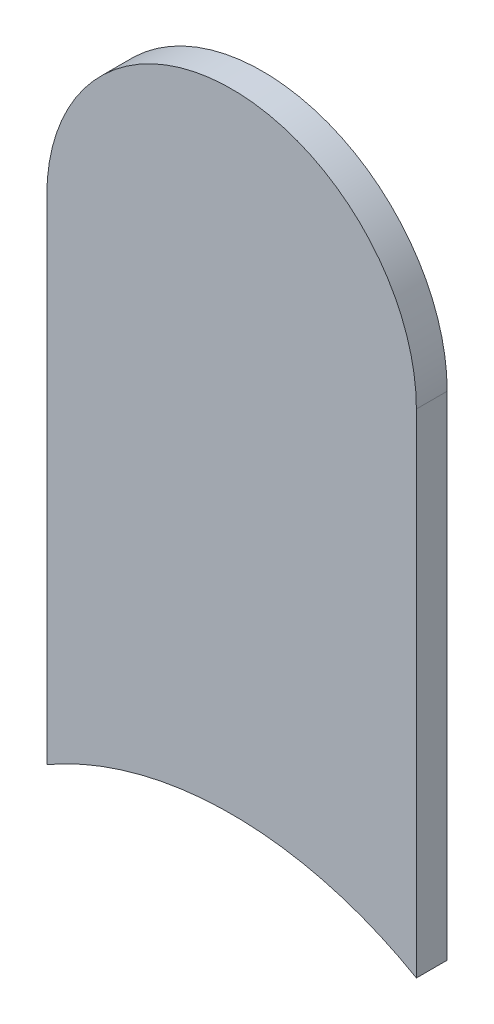
from build123d import *

# Parameters (mm, degrees)
BOSS_EXTRUDE1_DEPTH = 3.175


with BuildPart() as part:
    # Sketch1 → Boss-Extrude1 (new body)
    with BuildSketch(Plane.XY):
        with BuildLine():
            Line((0, 0), (0, 50.8))
            ThreePointArc((0, 50.8), (19.05, 69.85), (38.1, 50.8))
            Line((38.1, 50.8), (38.1, 0))
            ThreePointArc((38.1, 0), (19.05, 5.104432116), (0, 0))
        make_face()
    extrude(amount=BOSS_EXTRUDE1_DEPTH)


solid = part.part
